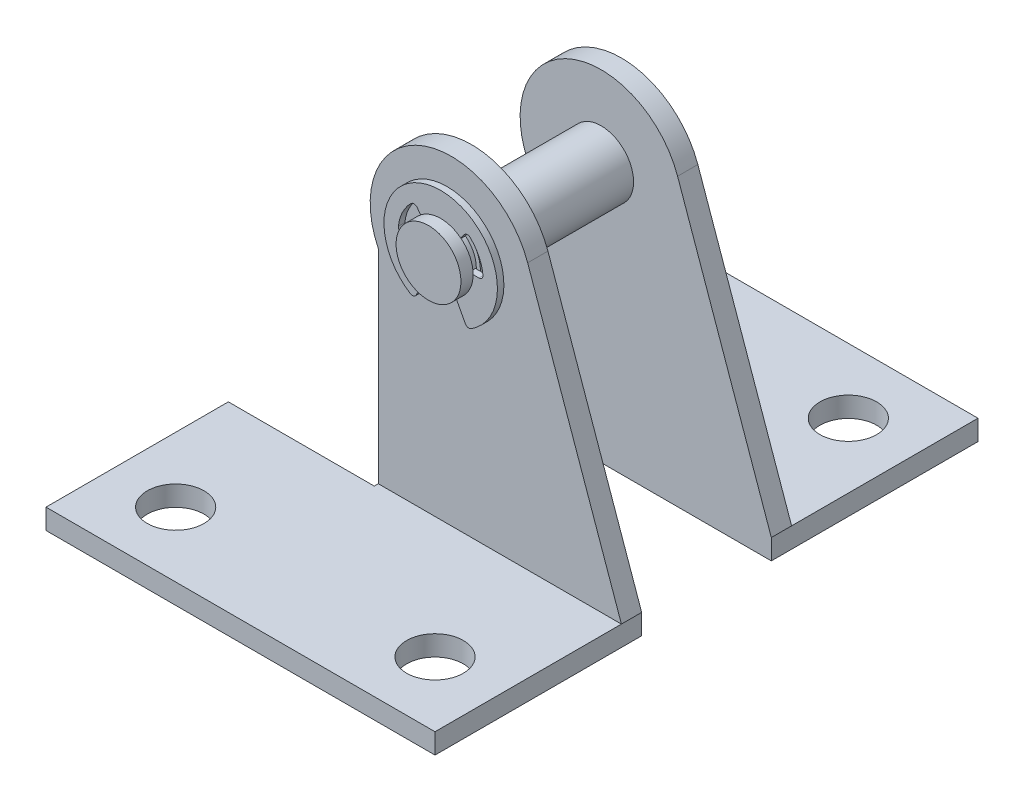
from build123d import *

# Parameters (mm, degrees)
EXTRUDE_1_DEPTH      = 10.5
EXTRUDE_1_DEPTH_BACK = 10.5
SKETCH_3_W           = 16
SKETCH_3_H           = 52
SKETCH_4_R           = 3.5
EXTRUDE_2_DEPTH      = 2.5
SKETCH_5_W           = 22
SKETCH_5_H           = 2.5
CUT_EXTRUDE_1_DEPTH  = 18
EXTRUDE_START        = -0.8
EXTRUDE_3_DEPTH      = 0.8
EXTRUDE_4_DEPTH      = 0.8


with BuildPart() as part:
    # 草图1 → 旋转1 (revolve)
    with BuildSketch(Plane(origin=(0, 0, 0), x_dir=(0, 0, -1), z_dir=(1, 0, 0))):
        Polygon((-13.3, 0), (-13.3, 4), (-11.8, 4), (-11.8, 3.5), (-10.9, 3.5), (-10.9, 4), (10.9, 4), (10.9, 3.5), (11.8, 3.5), (11.8, 4), (13.3, 4), (13.3, 0), align=None)
    revolve(axis=Axis((0, 0, -13.3), (0, 0, 1)))

    # 草图2 → 凸台-拉伸1 (add, two sides: drawn at the far end of the back side and taken through both)
    with BuildSketch(Plane.XY.offset(-EXTRUDE_1_DEPTH_BACK)):
        with BuildLine():
            Line((-9, -4.358898944), (-9, -32))
            Line((-9, -32), (21, -32))
            Line((21, -32), (21, -29.5))
            Line((21, -29.5), (9.431374679, 3.324029432))
            ThreePointArc((9.431374679, 3.324029432), (-3.84751454, 9.230202157), (-9, -4.358898944))
        make_face()
    extrude(amount=EXTRUDE_1_DEPTH + EXTRUDE_1_DEPTH_BACK)

    # 草图3 → 切除-旋转1 (revolve, cut)
    with BuildSketch(Plane(origin=(0, 0, 0), x_dir=(0, 0, -1), z_dir=(1, 0, 0))):
        with Locations((0, 30)):
            Rectangle(SKETCH_3_W, SKETCH_3_H)
    revolve(axis=Axis((0, 0, -10), (0, 0, 1)), mode=Mode.SUBTRACT)

    # 草图4 → 凸台-拉伸2 (add)
    with BuildSketch(Plane(origin=(0, -32, 0), x_dir=(1, 0, 0), z_dir=(0, 1, 0))):
        Polygon((-27, 33.5), (-27, -33.5), (21, -33.5), (21, -8), (-9, -8), (-9, 8), (21, 8), (21, 33.5), align=None)
        with Locations((13, 25.5)):
            Circle(SKETCH_4_R, mode=Mode.SUBTRACT)
        with Locations((13, -25.5)):
            Circle(SKETCH_4_R, mode=Mode.SUBTRACT)
        with Locations((-19, 25.5)):
            Circle(SKETCH_4_R, mode=Mode.SUBTRACT)
        with Locations((-19, -25.5)):
            Circle(SKETCH_4_R, mode=Mode.SUBTRACT)
    extrude(amount=EXTRUDE_2_DEPTH)

    # 草图5 → 切除-拉伸1 (cut)
    with BuildSketch(Plane(origin=(-9, 0, 0), x_dir=(0, 0, -1), z_dir=(1, 0, 0))):
        with Locations((0, -30.75)):
            Rectangle(SKETCH_5_W, SKETCH_5_H)
    extrude(amount=-CUT_EXTRUDE_1_DEPTH, mode=Mode.SUBTRACT)

    # 草图6 → 凸台-拉伸3 (add)
    with BuildSketch(Plane.XY.offset(11.8).offset(EXTRUDE_START)):
        with BuildLine():
            Line((-3.042523464, -5.7221544), (-1.64315047, -3.090316575))
            ThreePointArc((-1.64315047, -3.090316575), (-3.000085552, -1.802633262), (-3.5, 0))
            Line((-3.5, 0), (-4.723610907, 0))
            ThreePointArc((-4.723610907, 0), (-5.095306878, 0.165571973), (-5.220833108, 0.552631579))
            ThreePointArc((-5.220833108, 0.552631579), (-4.718668743, 2.301448521), (-3.64974544, 3.773838658))
            ThreePointArc((-3.64974544, 3.773838658), (-3.267456645, 3.913220327), (-2.90814526, 3.722256191))
            Line((-2.90814526, 3.722256191), (-2.154815164, 2.758037638))
            ThreePointArc((-2.154815164, 2.758037638), (0, 3.5), (2.154815164, 2.758037638))
            Line((2.154815164, 2.758037638), (2.90814526, 3.722256191))
            ThreePointArc((2.90814526, 3.722256191), (3.26745663, 3.913220326), (3.64974542, 3.773838678))
            ThreePointArc((3.64974542, 3.773838678), (4.718668737, 2.301448534), (5.220833108, 0.552631579))
            ThreePointArc((5.220833108, 0.552631579), (5.095306878, 0.165571973), (4.723610907, 0))
            Line((4.723610907, 0), (3.5, 0))
            ThreePointArc((3.5, 0), (3.000085552, -1.802633262), (1.64315047, -3.090316575))
            Line((1.64315047, -3.090316575), (3.042523464, -5.7221544))
            ThreePointArc((3.042523464, -5.7221544), (3.356323848, -5.970843379), (3.751997049, -5.909527743))
            ThreePointArc((3.751997049, -5.909527743), (0, 7), (-3.751997049, -5.909527743))
            ThreePointArc((-3.751997049, -5.909527743), (-3.356323848, -5.970843379), (-3.042523464, -5.7221544))
        make_face()
    extrude(amount=EXTRUDE_3_DEPTH)

    # 草图7 → 凸台-拉伸4 (add)
    with BuildSketch(Plane.XY.offset(-11.8)):
        with BuildLine():
            Line((-3.042523464, -5.7221544), (-1.64315047, -3.090316575))
            ThreePointArc((-1.64315047, -3.090316575), (-3.000085552, -1.802633262), (-3.5, 0))
            Line((-3.5, 0), (-4.723610907, 0))
            ThreePointArc((-4.723610907, 0), (-5.095306878, 0.165571973), (-5.220833108, 0.552631579))
            ThreePointArc((-5.220833108, 0.552631579), (-4.718668743, 2.301448521), (-3.64974544, 3.773838658))
            ThreePointArc((-3.64974544, 3.773838658), (-3.267456645, 3.913220327), (-2.90814526, 3.722256191))
            Line((-2.90814526, 3.722256191), (-2.154815164, 2.758037638))
            ThreePointArc((-2.154815164, 2.758037638), (0, 3.5), (2.154815164, 2.758037638))
            Line((2.154815164, 2.758037638), (2.90814526, 3.722256191))
            ThreePointArc((2.90814526, 3.722256191), (3.26745663, 3.913220326), (3.64974542, 3.773838678))
            ThreePointArc((3.64974542, 3.773838678), (4.718668737, 2.301448534), (5.220833108, 0.552631579))
            ThreePointArc((5.220833108, 0.552631579), (5.095306878, 0.165571973), (4.723610907, 0))
            Line((4.723610907, 0), (3.5, 0))
            ThreePointArc((3.5, 0), (3.000085552, -1.802633262), (1.64315047, -3.090316575))
            Line((1.64315047, -3.090316575), (3.042523464, -5.7221544))
            ThreePointArc((3.042523464, -5.7221544), (3.356323848, -5.970843379), (3.751997049, -5.909527743))
            ThreePointArc((3.751997049, -5.909527743), (0, 7), (-3.751997049, -5.909527743))
            ThreePointArc((-3.751997049, -5.909527743), (-3.356323848, -5.970843379), (-3.042523464, -5.7221544))
        make_face()
    extrude(amount=EXTRUDE_4_DEPTH)


solid = part.part
